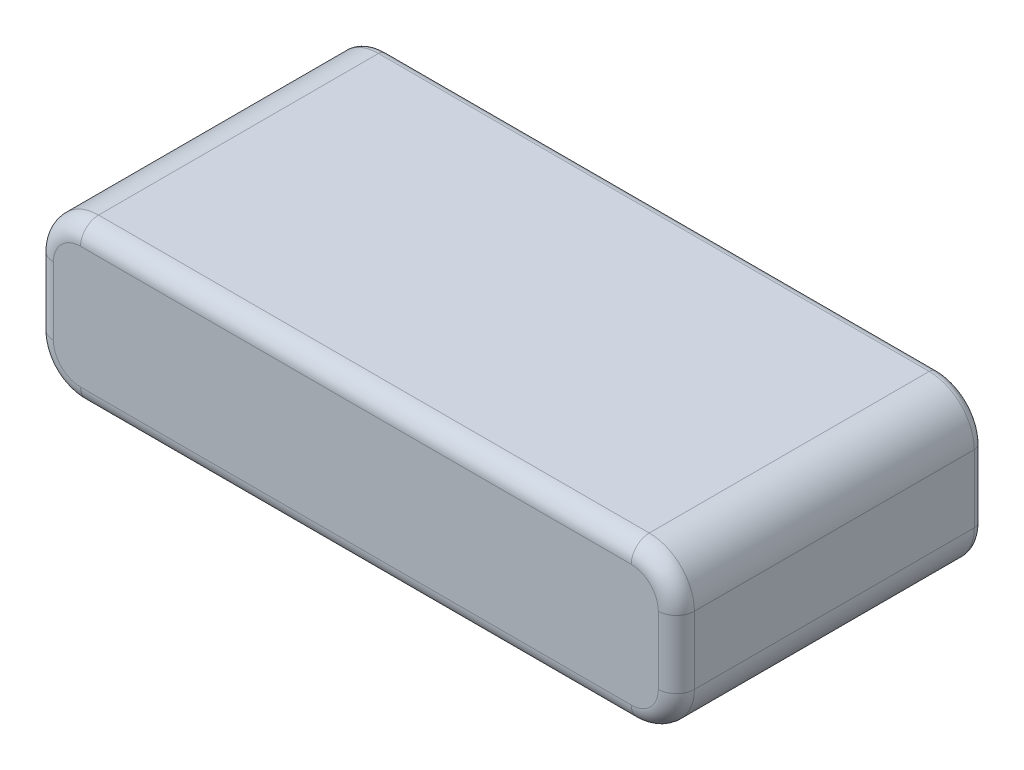
from build123d import *

# Parameters (mm, degrees)
SKETCH1_W           = 71
SKETCH1_H           = 34
BOSS_EXTRUDE1_DEPTH = 17.5
FILLET1_R           = 5
FILLET2_R           = 2
FILLET3_R           = 1


with BuildPart() as part:
    # Sketch1 → Boss-Extrude1 (new body)
    with BuildSketch(Plane(origin=(0, 0, 0), x_dir=(1, 0, 0), z_dir=(0, 1, 0))):
        Rectangle(SKETCH1_W, SKETCH1_H)
    extrude(amount=BOSS_EXTRUDE1_DEPTH)

    # Fillet1
    fillet1_edges = [part.edges().sort_by_distance(p)[0] for p in [
        (35.5, 17.5, 0),
        (-35.5, 17.5, 0),
        (35.5, 0, 0),
        (-35.5, 0, 0),
    ]]
    fillet(fillet1_edges, radius=FILLET1_R)

    # Fillet2
    fillet2_edges = [part.edges().sort_by_distance(p)[0] for p in [
        (-35.5, 8.75, 17),
        (0, 0, 17),
        (35.5, 8.75, 17),
        (0, 17.5, 17),
        (-34.035533906, 16.035533906, 17),
        (34.035533906, 16.035533906, 17),
        (34.035533906, 1.464466094, 17),
        (-34.035533906, 1.464466094, 17),
    ]]
    fillet(fillet2_edges, radius=FILLET2_R)

    # Fillet3
    fillet3_edges = [part.edges().sort_by_distance(p)[0] for p in [
        (-35.5, 8.75, -17),
        (0, 0, -17),
        (0, 17.5, -17),
        (35.5, 8.75, -17),
        (-34.035533906, 16.035533906, -17),
        (34.035533906, 16.035533906, -17),
        (34.035533906, 1.464466094, -17),
        (-34.035533906, 1.464466094, -17),
    ]]
    fillet(fillet3_edges, radius=FILLET3_R)


solid = part.part
